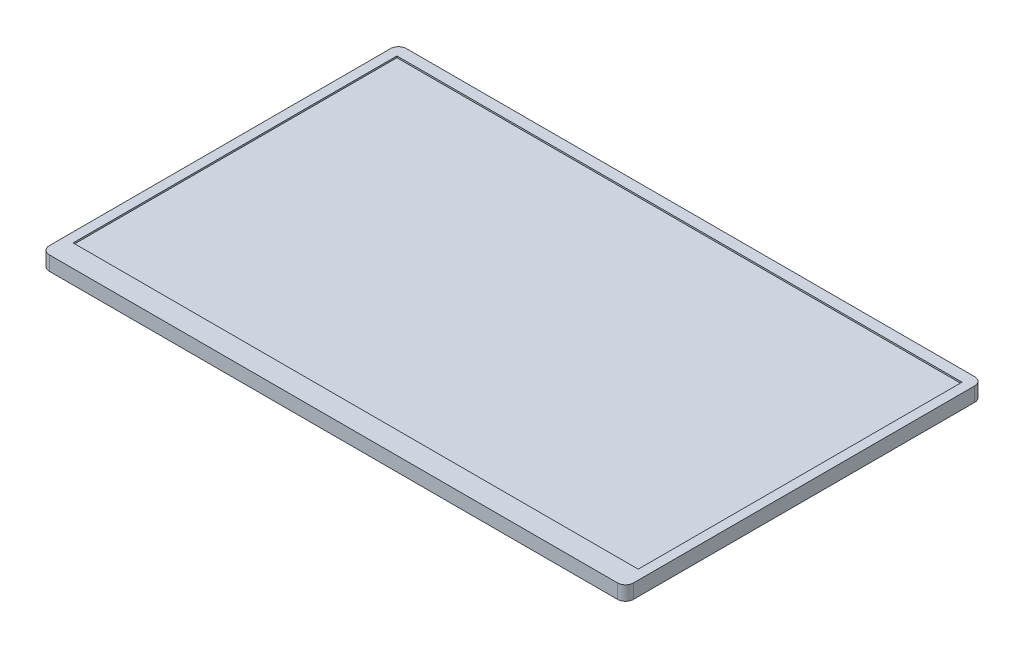
from build123d import *

# Parameters (mm, degrees)
SKETCH_1_W          = 368
SKETCH_1_H          = 225
EXTRUDE_1_DEPTH     = 9
FILLET_1_R          = 5
SKETCH_2_W          = 356
SKETCH_2_H          = 204
CUT_EXTRUDE_1_DEPTH = 1


with BuildPart() as part:
    # 草图1 → 凸台-拉伸1 (new body)
    with BuildSketch(Plane(origin=(0, 0, 0), x_dir=(1, 0, 0), z_dir=(0, 1, 0))):
        Rectangle(SKETCH_1_W, SKETCH_1_H)
    extrude(amount=EXTRUDE_1_DEPTH)

    # 圆角1
    fillet_1_edges = [part.edges().sort_by_distance(p)[0] for p in [
        (-184, 4.5, -112.5),
        (184, 4.5, -112.5),
        (184, 4.5, 112.5),
        (-184, 4.5, 112.5),
    ]]
    fillet(fillet_1_edges, radius=FILLET_1_R)

    # 草图2 → 切除-拉伸1 (cut)
    with BuildSketch(Plane(origin=(0, 9, 0), x_dir=(1, 0, 0), z_dir=(0, 1, 0))):
        with Locations((0, 3.5)):
            Rectangle(SKETCH_2_W, SKETCH_2_H)
    extrude(amount=-CUT_EXTRUDE_1_DEPTH, mode=Mode.SUBTRACT)


solid = part.part
